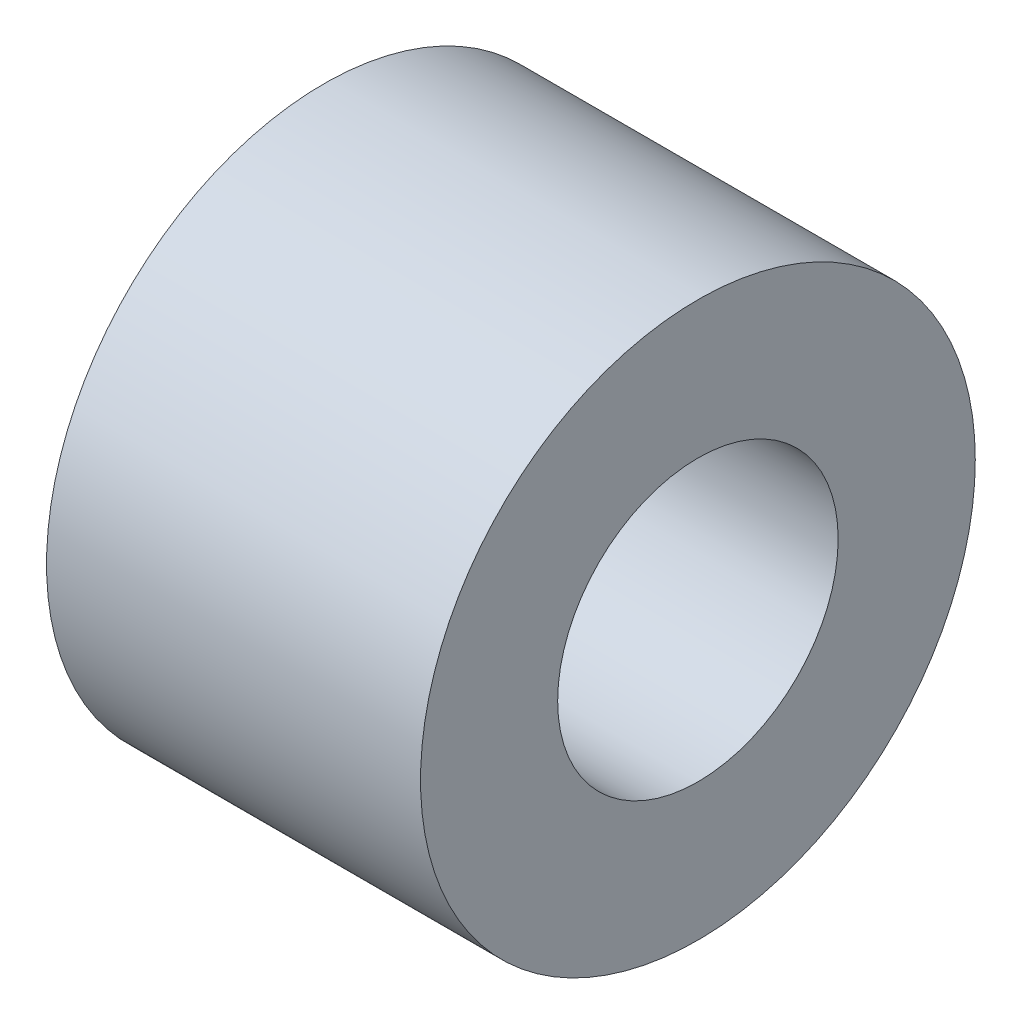
from build123d import *

# Parameters (mm, degrees)
SKETCH1_R           = 22.25
SKETCH1_R_2         = 11.25
BOSS_EXTRUDE1_DEPTH = 30


with BuildPart() as part:
    # Sketch1 → Boss-Extrude1 (new body)
    with BuildSketch(Plane(origin=(0, 0, 0), x_dir=(0, 0, -1), z_dir=(1, 0, 0))):
        Circle(SKETCH1_R)
        Circle(SKETCH1_R_2, mode=Mode.SUBTRACT)
    extrude(amount=BOSS_EXTRUDE1_DEPTH)


solid = part.part
